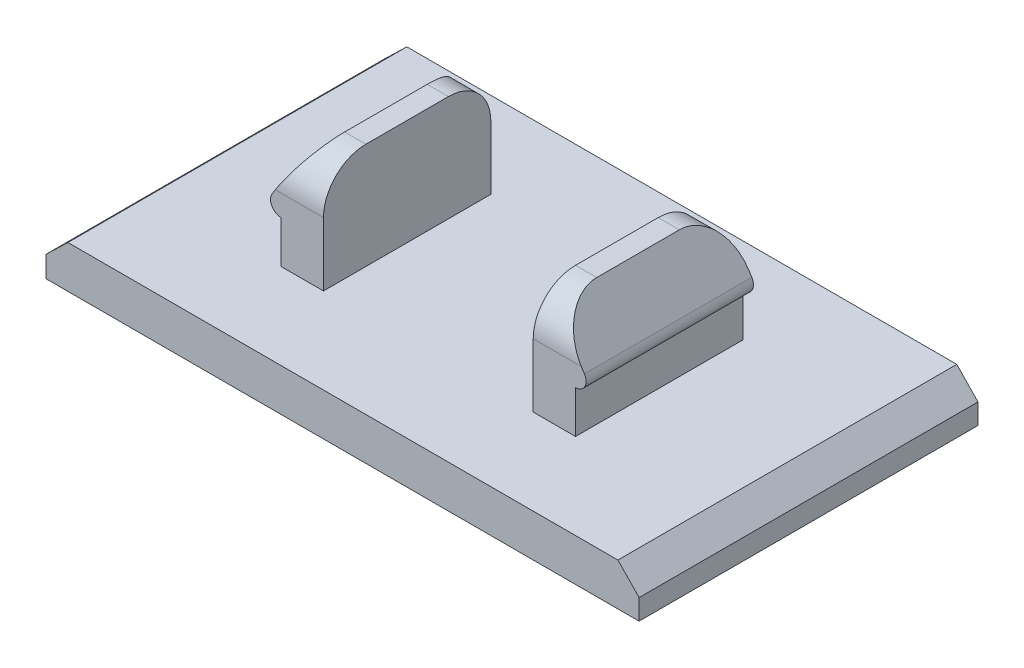
from build123d import *
from OCP.BRepFilletAPI import BRepFilletAPI_MakeChamfer

# Parameters (mm, degrees)
SKETCH1_W           = 28
SKETCH1_H           = 16
BOSS_EXTRUDE1_DEPTH = 2
CHAMFER1_SIZE       = 1
CHAMFER1_SIZE2      = 1.035530314
SKETCH1_3_W         = 2
SKETCH1_3_H         = 7.9
BOSS_EXTRUDE2_DEPTH = 7
CUT_EXTRUDE1_DEPTH  = 20.692701694
SKETCH2_3_R         = 0.5
BOSS_EXTRUDE3_DEPTH = 7.9
FILLET1_R           = 2


with BuildPart() as part:
    # Sketch1 → Boss-Extrude1 (new body)
    with BuildSketch(Plane(origin=(0, 0, 0), x_dir=(1, 0, 0), z_dir=(0, 1, 0))):
        Rectangle(SKETCH1_W, SKETCH1_H)
    extrude(amount=BOSS_EXTRUDE1_DEPTH)

    # Chamfer1: one chamfer whose edges measure the first distance from different faces: ONE call of the kernel's chamfer builder (chamfer() names one face for all edges)
    chamfer1_edges_1 = [part.edges().sort_by_distance(p)[0] for p in [
        (14, 2, 0),
    ]]
    chamfer1_side_1 = [part.faces().sort_by_distance(p)[0] for p in [
        (0, 2, 0),
    ]]
    chamfer1_edges_2 = [part.edges().sort_by_distance(p)[0] for p in [
        (-14, 2, 0),
    ]]
    chamfer1_side_2 = [part.faces().sort_by_distance(p)[0] for p in [
        (-14, 1, 0),
    ]]
    chamfer1 = BRepFilletAPI_MakeChamfer(part.part.solid().wrapped)
    for e in chamfer1_edges_1:
        chamfer1.Add(CHAMFER1_SIZE, CHAMFER1_SIZE2, e.wrapped, chamfer1_side_1[0].wrapped)  # the first distance lies on this face
    for e in chamfer1_edges_2:
        chamfer1.Add(CHAMFER1_SIZE, CHAMFER1_SIZE2, e.wrapped, chamfer1_side_2[0].wrapped)  # the first distance lies on this face
    add(Compound.cast(chamfer1.Shape()), mode=Mode.REPLACE)

    # Sketch1<3> → Boss-Extrude2 (add)
    with BuildSketch(Plane(origin=(0, 0, 0), x_dir=(1, 0, 0), z_dir=(0, 1, 0))):
        with Locations((-5.95, 0)):
            Rectangle(SKETCH1_3_W, SKETCH1_3_H)
        with Locations((5.95, 0)):
            Rectangle(SKETCH1_3_W, SKETCH1_3_H)
    extrude(amount=BOSS_EXTRUDE2_DEPTH)

    # Sketch2 → Cut-Extrude1 (cut, through all)
    with BuildSketch(Plane.XY.offset(3.95)):
        Polygon((-6.95, 7), (-6.95, 5.430500874), (-5.95, 7), align=None)
        with BuildLine():
            Line((7.45, 4.5), (7.45, 7))
            Line((7.45, 7), (5.95, 7))
            Line((5.95, 7), (7.371681261, 4.768672504))
            ThreePointArc((7.371681261, 4.768672504), (7.430021161, 4.639927427), (7.45, 4.5))
        make_face()
    extrude(amount=-CUT_EXTRUDE1_DEPTH, mode=Mode.SUBTRACT)

    # Sketch2<3> → Boss-Extrude3 (add)
    with BuildSketch(Plane.XY.offset(3.95)):
        with BuildLine():
            ThreePointArc((-6.95, 5), (-7.190482586, 4.938369851), (-7.371681261, 4.768672504))
            ThreePointArc((-7.371681261, 4.768672504), (-7.430021161, 4.639927427), (-7.45, 4.5))
            ThreePointArc((-7.45, 4.5), (-7.303553391, 4.146446609), (-6.95, 4))
            Line((-6.95, 4), (-6.95, 5))
        make_face()
        with BuildLine():
            ThreePointArc((-6.45, 4.5), (-6.596446609, 4.853553391), (-6.95, 5))
            Line((-6.95, 5), (-6.95, 4))
            ThreePointArc((-6.95, 4), (-6.596446609, 4.146446609), (-6.45, 4.5))
        make_face()
        with BuildLine():
            Line((-6.95, 5.430500874), (-7.371681261, 4.768672504))
            ThreePointArc((-7.371681261, 4.768672504), (-7.190482586, 4.938369851), (-6.95, 5))
            Line((-6.95, 5), (-6.95, 5.430500874))
        make_face()
        with Locations((6.95, 4.5)):
            Circle(SKETCH2_3_R)
        with BuildLine():
            Line((7.371681261, 4.768672504), (5.95, 7))
            Line((5.95, 7), (5.95, 4.5))
            Line((5.95, 4.5), (6.45, 4.5))
            ThreePointArc((6.45, 4.5), (6.810072573, 4.980021161), (7.371681261, 4.768672504))
        make_face()
    extrude(amount=-BOSS_EXTRUDE3_DEPTH)

    # Fillet1
    fillet1_edges = [part.edges().sort_by_distance(p)[0] for p in [
        (5.45, 7, -3.95),
        (5.45, 7, 3.95),
        (-5.45, 7, 3.95),
        (-5.45, 7, -3.95),
    ]]
    fillet(fillet1_edges, radius=FILLET1_R)


solid = part.part
